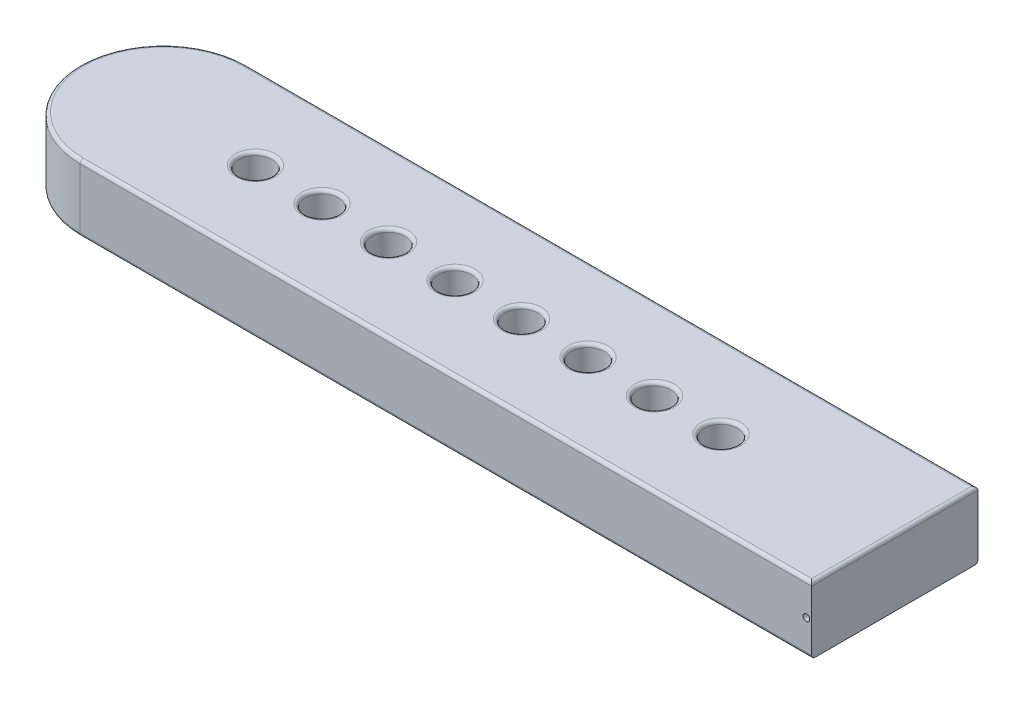
from build123d import *

# Parameters (mm, degrees)
CROQUIS1_R              = 0.25
SALIENTE_EXTRUIR1_DEPTH = 1
REDONDEO2_R             = 0.05
CROQUIS2_R              = 0.05
CORTAR_EXTRUIR1_DEPTH   = 13.542428092


with BuildPart() as part:
    # Croquis1 → Saliente-Extruir1 (new body)
    with BuildSketch(Plane(origin=(0, 0, 0), x_dir=(1, 0, 0), z_dir=(0, 1, 0))):
        with BuildLine():
            Line((0, 2.5), (-11, 2.5))
            ThreePointArc((-11, 2.5), (-12.25, 1.25), (-11, 0))
            Line((-11, 0), (0, 0))
            Line((0, 0), (0, 2.5))
        make_face()
        with Locations(Location((-9.61511146, 1.25, 0), (0, 0, 270))):
            Circle(CROQUIS1_R, mode=Mode.SUBTRACT)
        with Locations(Location((-8.61511146, 1.25, 0), (0, 0, 270))):
            Circle(CROQUIS1_R, mode=Mode.SUBTRACT)
        with Locations(Location((-7.61511146, 1.25, 0), (0, 0, 270))):
            Circle(CROQUIS1_R, mode=Mode.SUBTRACT)
        with Locations(Location((-6.61511146, 1.25, 0), (0, 0, 270))):
            Circle(CROQUIS1_R, mode=Mode.SUBTRACT)
        with Locations(Location((-5.61511146, 1.25, 0), (0, 0, 270))):
            Circle(CROQUIS1_R, mode=Mode.SUBTRACT)
        with Locations(Location((-4.61511146, 1.25, 0), (0, 0, 270))):
            Circle(CROQUIS1_R, mode=Mode.SUBTRACT)
        with Locations(Location((-3.61511146, 1.25, 0), (0, 0, 270))):
            Circle(CROQUIS1_R, mode=Mode.SUBTRACT)
        with Locations(Location((-2.61511146, 1.25, 0), (0, 0, 270))):
            Circle(CROQUIS1_R, mode=Mode.SUBTRACT)
    extrude(amount=SALIENTE_EXTRUIR1_DEPTH)

    # Redondeo2
    redondeo2_edges = [part.edges().sort_by_distance(p)[0] for p in [
        (-9.61511146, 0, -1.5),
        (-9.61511146, 1, -1.5),
        (-12.25, 1, -1.25),
        (-8.61511146, 0, -1.5),
        (-8.61511146, 1, -1.5),
        (-5.5, 1, 0),
        (-7.61511146, 0, -1.5),
        (-7.61511146, 1, -1.5),
        (-6.61511146, 0, -1.5),
        (-6.61511146, 1, -1.5),
        (-5.61511146, 0, -1.5),
        (-5.61511146, 1, -1.5),
        (-4.61511146, 0, -1.5),
        (-4.61511146, 1, -1.5),
        (-3.61511146, 0, -1.5),
        (-3.61511146, 1, -1.5),
        (-2.61511146, 0, -1.5),
        (-2.61511146, 1, -1.5),
        (0, 1, -1.25),
        (-5.5, 0, 0),
        (-12.25, 0, -1.25),
        (-5.5, 0, -2.5),
        (-5.5, 1, -2.5),
    ]]
    fillet(redondeo2_edges, radius=REDONDEO2_R)

    # Croquis2 → Cortar-Extruir1 (cut, through all)
    with BuildSketch(Plane.XY):
        with Locations((-0.08, 0.502227407)):
            Circle(CROQUIS2_R)
    extrude(amount=-CORTAR_EXTRUIR1_DEPTH, mode=Mode.SUBTRACT)


solid = part.part
